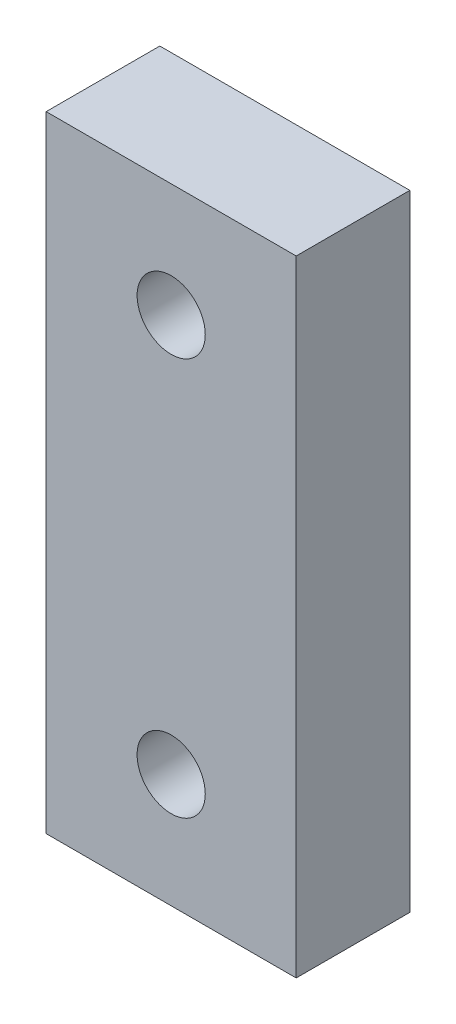
from build123d import *

# Parameters (mm, degrees)
SKETCH1_W           = 11
SKETCH1_H           = 27.51
BOSS_EXTRUDE2_DEPTH = 5
SKETCH3_R           = 1.5
CUT_EXTRUDE1_DEPTH  = 5
BOSS_EXTRUDE3_START = -5
SKETCH4_R           = 1.5
SKETCH4_R_2         = 0.75
BOSS_EXTRUDE3_DEPTH = 5
SKETCH6_R           = 1.5
CUT_EXTRUDE2_DEPTH  = 50


with BuildPart() as part:
    # Sketch1 → Boss-Extrude2 (new body)
    with BuildSketch(Plane.XY):
        Rectangle(SKETCH1_W, SKETCH1_H)
    extrude(amount=BOSS_EXTRUDE2_DEPTH)

    # Sketch3 → Cut-Extrude1 (cut)
    with BuildSketch(Plane.XY.offset(5)):
        with Locations((0, 8.755)):
            Circle(SKETCH3_R)
        with Locations((0, -8.745)):
            Circle(SKETCH3_R)
    extrude(amount=-CUT_EXTRUDE1_DEPTH, mode=Mode.SUBTRACT)

    # Sketch4 → Boss-Extrude3 (add)
    # profile 1 of 2: a face of its own
    with BuildSketch(Plane(origin=(0, 0, 0), x_dir=(-1, 0, 0), z_dir=(0, 0, -1)).offset(BOSS_EXTRUDE3_START)):
        with Locations((0, 8.755)):
            Circle(SKETCH4_R)
        with Locations((0, 8.755)):
            Circle(SKETCH4_R_2, mode=Mode.SUBTRACT)
    # profile 2 of 2: a face of its own
    with BuildSketch(Plane(origin=(0, 0, 0), x_dir=(-1, 0, 0), z_dir=(0, 0, -1)).offset(BOSS_EXTRUDE3_START)):
        with Locations((0, -8.745)):
            Circle(SKETCH4_R)
        with Locations((0, -8.745)):
            Circle(SKETCH4_R_2, mode=Mode.SUBTRACT)
    extrude(amount=BOSS_EXTRUDE3_DEPTH)

    # Sketch6 → Cut-Extrude2 (cut)
    with BuildSketch(Plane(origin=(0, 0, 0), x_dir=(-1, 0, 0), z_dir=(0, 0, -1))):
        with Locations((0, 8.755)):
            Circle(SKETCH6_R)
        with Locations((0, -8.745)):
            Circle(SKETCH6_R)
    extrude(amount=-CUT_EXTRUDE2_DEPTH, mode=Mode.SUBTRACT)


solid = part.part
